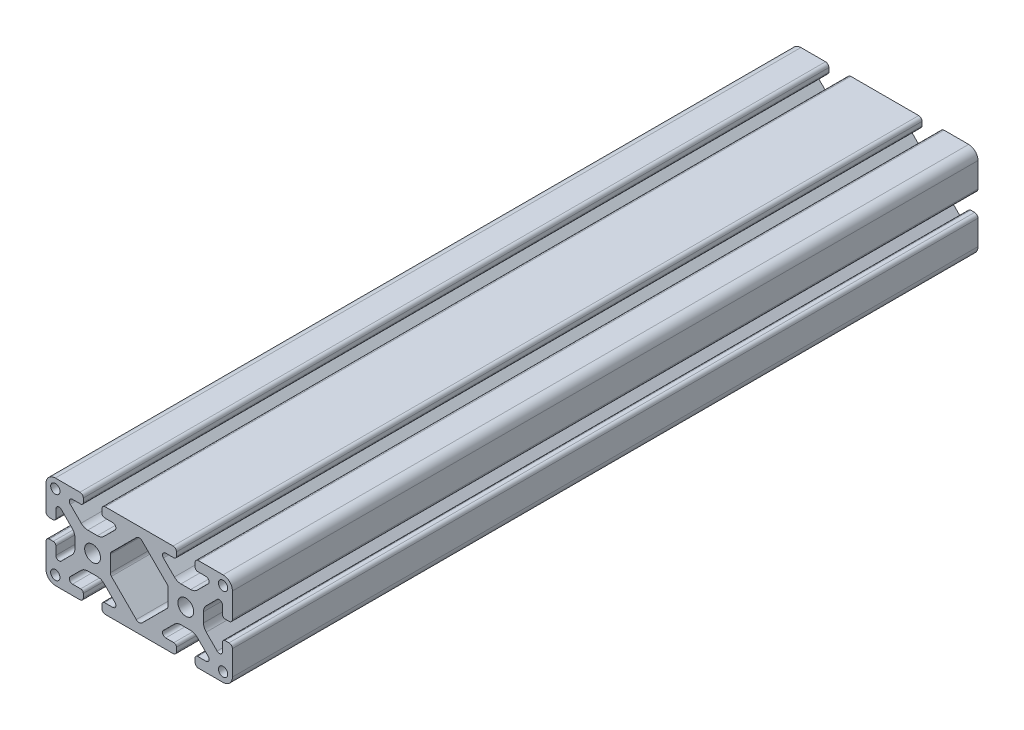
from build123d import *

# Parameters (mm, degrees)
SKETCH4_W              = 100
SKETCH4_H              = 50
BODY_DEPTH             = 400
CUT_PROFILE_DEPTH      = 208.665596573
CUT_PROFILE_DEPTH_BACK = 208.665596573
SKETCH6_OUTSIDE_W      = 185.066
SKETCH6_OUTSIDE_H      = 135.066
SKETCH6_OUTSIDE_R      = 4.25
SKETCH6_OUTSIDE_R_2    = 2.5


with BuildPart() as part:
    # Sketch4 → Body (new body)
    with BuildSketch(Plane.XY.offset(200)):
        Rectangle(SKETCH4_W, SKETCH4_H)
    extrude(amount=-BODY_DEPTH)

    # Sketch6 outside → Cut-Profile (cut, two sides: drawn at the far end of the back side and taken through both)
    # profile 1 of 8: a face of its own
    with BuildSketch(Plane.XY.offset(-CUT_PROFILE_DEPTH_BACK)):
        Rectangle(SKETCH6_OUTSIDE_W, SKETCH6_OUTSIDE_H)
        with BuildLine():
            Line((-31.4, -19.7), (-35.8, -19.7))
            ThreePointArc((-35.8, -19.7), (-37.371513222, -18.648341109), (-36.998678382, -16.794524933))
            Line((-36.998678382, -16.794524933), (-31.125524653, -10.954485098))
            ThreePointArc((-31.125524653, -10.954485098), (-29.506885614, -9.877902288), (-27.6, -9.5))
            Line((-27.6, -9.5), (-22.4, -9.5))
            ThreePointArc((-22.4, -9.5), (-20.493114386, -9.877902288), (-18.874475347, -10.954485098))
            Line((-18.874475347, -10.954485098), (-13.001321618, -16.794524933))
            ThreePointArc((-13.001321618, -16.794524933), (-12.628486778, -18.648341109), (-14.2, -19.7))
            Line((-14.2, -19.7), (-18.6, -19.7))
            ThreePointArc((-18.6, -19.7), (-19.589949494, -20.110050506), (-20, -21.1))
            Line((-20, -21.1), (-20, -23.2))
            ThreePointArc((-20, -23.2), (-19.472792206, -24.472792206), (-18.2, -25))
            Line((-18.2, -25), (18.2, -25))
            ThreePointArc((18.2, -25), (19.472792206, -24.472792206), (20, -23.2))
            Line((20, -23.2), (20, -21.1))
            ThreePointArc((20, -21.1), (19.589949494, -20.110050506), (18.6, -19.7))
            Line((18.6, -19.7), (14.2, -19.7))
            ThreePointArc((14.2, -19.7), (12.628486778, -18.648341109), (13.001321618, -16.794524933))
            Line((13.001321618, -16.794524933), (18.874475347, -10.954485098))
            ThreePointArc((18.874475347, -10.954485098), (20.493114386, -9.877902288), (22.4, -9.5))
            Line((22.4, -9.5), (27.6, -9.5))
            ThreePointArc((27.6, -9.5), (29.506885614, -9.877902288), (31.125524653, -10.954485098))
            Line((31.125524653, -10.954485098), (36.998678382, -16.794524933))
            ThreePointArc((36.998678382, -16.794524933), (37.371513222, -18.648341109), (35.8, -19.7))
            Line((35.8, -19.7), (31.4, -19.7))
            ThreePointArc((31.4, -19.7), (30.410050506, -20.110050506), (30, -21.1))
            Line((30, -21.1), (30, -23.2))
            ThreePointArc((30, -23.2), (30.527207794, -24.472792206), (31.8, -25))
            Line((31.8, -25), (45, -25))
            ThreePointArc((45, -25), (48.535533906, -23.535533906), (50, -20))
            Line((50, -20), (50, -6.8))
            ThreePointArc((50, -6.8), (49.472792206, -5.527207794), (48.2, -5))
            Line((48.2, -5), (46.1, -5))
            ThreePointArc((46.1, -5), (45.110050506, -5.410050506), (44.7, -6.4))
            Line((44.7, -6.4), (44.7, -10.8))
            ThreePointArc((44.7, -10.8), (43.648341109, -12.371513222), (41.794524933, -11.998678382))
            Line((41.794524933, -11.998678382), (35.954485098, -6.125524653))
            ThreePointArc((35.954485098, -6.125524653), (34.877902288, -4.506885614), (34.5, -2.6))
            Line((34.5, -2.6), (34.5, 2.6))
            ThreePointArc((34.5, 2.6), (34.877902288, 4.506885614), (35.954485098, 6.125524653))
            Line((35.954485098, 6.125524653), (41.794524933, 11.998678382))
            ThreePointArc((41.794524933, 11.998678382), (43.648341109, 12.371513222), (44.7, 10.8))
            Line((44.7, 10.8), (44.7, 6.4))
            ThreePointArc((44.7, 6.4), (45.110050506, 5.410050506), (46.1, 5))
            Line((46.1, 5), (48.2, 5))
            ThreePointArc((48.2, 5), (49.472792206, 5.527207794), (50, 6.8))
            Line((50, 6.8), (50, 20))
            ThreePointArc((50, 20), (48.535533906, 23.535533906), (45, 25))
            Line((45, 25), (31.8, 25))
            ThreePointArc((31.8, 25), (30.527207794, 24.472792206), (30, 23.2))
            Line((30, 23.2), (30, 21.1))
            ThreePointArc((30, 21.1), (30.410050506, 20.110050506), (31.4, 19.7))
            Line((31.4, 19.7), (35.8, 19.7))
            ThreePointArc((35.8, 19.7), (37.371513222, 18.648341109), (36.998678382, 16.794524933))
            Line((36.998678382, 16.794524933), (31.125524653, 10.954485098))
            ThreePointArc((31.125524653, 10.954485098), (29.506885614, 9.877902288), (27.6, 9.5))
            Line((27.6, 9.5), (22.4, 9.5))
            ThreePointArc((22.4, 9.5), (20.493114386, 9.877902288), (18.874475347, 10.954485098))
            Line((18.874475347, 10.954485098), (13.001321618, 16.794524933))
            ThreePointArc((13.001321618, 16.794524933), (12.628486778, 18.648341109), (14.2, 19.7))
            Line((14.2, 19.7), (18.6, 19.7))
            ThreePointArc((18.6, 19.7), (19.589949494, 20.110050506), (20, 21.1))
            Line((20, 21.1), (20, 23.2))
            ThreePointArc((20, 23.2), (19.472792206, 24.472792206), (18.2, 25))
            Line((18.2, 25), (-18.2, 25))
            ThreePointArc((-18.2, 25), (-19.472792206, 24.472792206), (-20, 23.2))
            Line((-20, 23.2), (-20, 21.1))
            ThreePointArc((-20, 21.1), (-19.589949494, 20.110050506), (-18.6, 19.7))
            Line((-18.6, 19.7), (-14.2, 19.7))
            ThreePointArc((-14.2, 19.7), (-12.628486778, 18.648341109), (-13.001321618, 16.794524933))
            Line((-13.001321618, 16.794524933), (-18.874475347, 10.954485098))
            ThreePointArc((-18.874475347, 10.954485098), (-20.493114386, 9.877902288), (-22.4, 9.5))
            Line((-22.4, 9.5), (-27.6, 9.5))
            ThreePointArc((-27.6, 9.5), (-29.506885614, 9.877902288), (-31.125524653, 10.954485098))
            Line((-31.125524653, 10.954485098), (-36.998678382, 16.794524933))
            ThreePointArc((-36.998678382, 16.794524933), (-37.371513222, 18.648341109), (-35.8, 19.7))
            Line((-35.8, 19.7), (-31.4, 19.7))
            ThreePointArc((-31.4, 19.7), (-30.410050506, 20.110050506), (-30, 21.1))
            Line((-30, 21.1), (-30, 23.2))
            ThreePointArc((-30, 23.2), (-30.527207794, 24.472792206), (-31.8, 25))
            Line((-31.8, 25), (-45, 25))
            ThreePointArc((-45, 25), (-48.535533906, 23.535533906), (-50, 20))
            Line((-50, 20), (-50, 6.8))
            ThreePointArc((-50, 6.8), (-49.472792206, 5.527207794), (-48.2, 5))
            Line((-48.2, 5), (-46.1, 5))
            ThreePointArc((-46.1, 5), (-45.110050506, 5.410050506), (-44.7, 6.4))
            Line((-44.7, 6.4), (-44.7, 10.8))
            ThreePointArc((-44.7, 10.8), (-43.648341109, 12.371513222), (-41.794524933, 11.998678382))
            Line((-41.794524933, 11.998678382), (-35.954485098, 6.125524653))
            ThreePointArc((-35.954485098, 6.125524653), (-34.877902288, 4.506885614), (-34.5, 2.6))
            Line((-34.5, 2.6), (-34.5, -2.6))
            ThreePointArc((-34.5, -2.6), (-34.877902288, -4.506885614), (-35.954485098, -6.125524653))
            Line((-35.954485098, -6.125524653), (-41.794524933, -11.998678382))
            ThreePointArc((-41.794524933, -11.998678382), (-43.648341109, -12.371513222), (-44.7, -10.8))
            Line((-44.7, -10.8), (-44.7, -6.4))
            ThreePointArc((-44.7, -6.4), (-45.110050506, -5.410050506), (-46.1, -5))
            Line((-46.1, -5), (-48.2, -5))
            ThreePointArc((-48.2, -5), (-49.472792206, -5.527207794), (-50, -6.8))
            Line((-50, -6.8), (-50, -20))
            ThreePointArc((-50, -20), (-48.535533906, -23.535533906), (-45, -25))
            Line((-45, -25), (-31.8, -25))
            ThreePointArc((-31.8, -25), (-30.527207794, -24.472792206), (-30, -23.2))
            Line((-30, -23.2), (-30, -21.1))
            ThreePointArc((-30, -21.1), (-30.410050506, -20.110050506), (-31.4, -19.7))
        make_face(mode=Mode.SUBTRACT)
    # profile 2 of 8: a face of its own
    with BuildSketch(Plane.XY.offset(-CUT_PROFILE_DEPTH_BACK)):
        with Locations((25, 0)):
            Circle(SKETCH6_OUTSIDE_R)
    # profile 3 of 8: a face of its own
    with BuildSketch(Plane.XY.offset(-CUT_PROFILE_DEPTH_BACK)):
        with Locations((45, -20)):
            Circle(SKETCH6_OUTSIDE_R_2)
    # profile 4 of 8: a face of its own
    with BuildSketch(Plane.XY.offset(-CUT_PROFILE_DEPTH_BACK)):
        with Locations((45, 20)):
            Circle(SKETCH6_OUTSIDE_R_2)
    # profile 5 of 8: a face of its own
    with BuildSketch(Plane.XY.offset(-CUT_PROFILE_DEPTH_BACK)):
        with Locations((-45, -20)):
            Circle(SKETCH6_OUTSIDE_R_2)
    # profile 6 of 8: a face of its own
    with BuildSketch(Plane.XY.offset(-CUT_PROFILE_DEPTH_BACK)):
        with Locations((-45, 20)):
            Circle(SKETCH6_OUTSIDE_R_2)
    # profile 7 of 8: a face of its own
    with BuildSketch(Plane.XY.offset(-CUT_PROFILE_DEPTH_BACK)):
        with Locations((-25, 0)):
            Circle(SKETCH6_OUTSIDE_R)
    # profile 8 of 8: a face of its own
    with BuildSketch(Plane.XY.offset(-CUT_PROFILE_DEPTH_BACK)):
        with BuildLine():
            Line((14.914213562, 5.685786438), (1.555634919, 19.044365081))
            ThreePointArc((1.555634919, 19.044365081), (0, 19.688730163), (-1.555634919, 19.044365081))
            Line((-1.555634919, 19.044365081), (-14.914213562, 5.685786438))
            ThreePointArc((-14.914213562, 5.685786438), (-15.347759065, 5.03693974), (-15.5, 4.271572875))
            Line((-15.5, 4.271572875), (-15.5, -4.271572875))
            ThreePointArc((-15.5, -4.271572875), (-15.347759065, -5.03693974), (-14.914213562, -5.685786438))
            Line((-14.914213562, -5.685786438), (-1.555634919, -19.044365081))
            ThreePointArc((-1.555634919, -19.044365081), (0, -19.688730163), (1.555634919, -19.044365081))
            Line((1.555634919, -19.044365081), (14.914213562, -5.685786438))
            ThreePointArc((14.914213562, -5.685786438), (15.347759065, -5.03693974), (15.5, -4.271572875))
            Line((15.5, -4.271572875), (15.5, 4.271572875))
            ThreePointArc((15.5, 4.271572875), (15.347759065, 5.03693974), (14.914213562, 5.685786438))
        make_face()
    extrude(amount=CUT_PROFILE_DEPTH + CUT_PROFILE_DEPTH_BACK, mode=Mode.SUBTRACT)


solid = part.part
